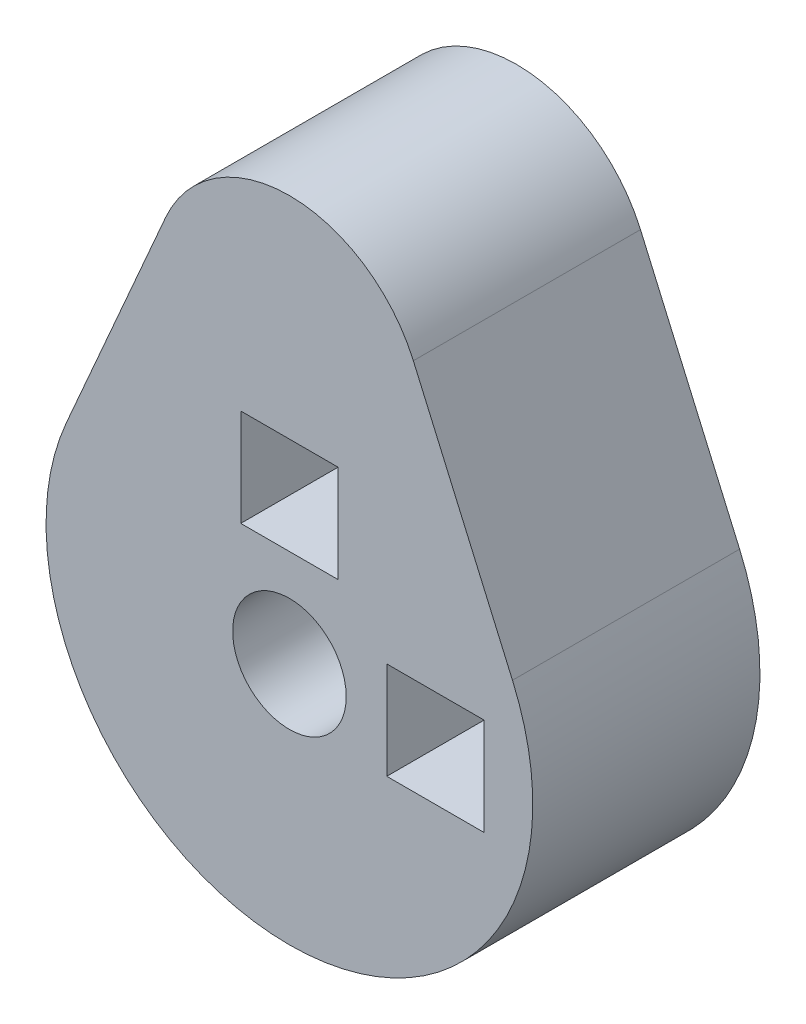
from build123d import *

# Parameters (mm, degrees)
SKETCH1_R           = 1.75
BOSS_EXTRUDE1_DEPTH = 7
SKETCH2_W           = 3
SKETCH2_H           = 3
CUT_EXTRUDE1_DEPTH  = 17.170961629


with BuildPart() as part:
    # Sketch1 → Boss-Extrude1 (new body)
    with BuildSketch(Plane.XY):
        with BuildLine():
            Line((-6.873863542, 3), (-3.818813079, 10))
            ThreePointArc((-3.818813079, 10), (0, 12.5), (3.818813079, 10))
            Line((3.818813079, 10), (6.873863542, 3))
            ThreePointArc((6.873863542, 3), (0, -7.5), (-6.873863542, 3))
        make_face()
        Circle(SKETCH1_R, mode=Mode.SUBTRACT)
    extrude(amount=BOSS_EXTRUDE1_DEPTH)

    # Sketch2 → Cut-Extrude1 (cut, through all)
    with BuildSketch(Plane.XY.offset(7)):
        with Locations((0, 4.5)):
            Rectangle(SKETCH2_W, SKETCH2_H)
        with Locations((4.5, 0)):
            Rectangle(SKETCH2_W, SKETCH2_H)
    extrude(amount=-CUT_EXTRUDE1_DEPTH, mode=Mode.SUBTRACT)


solid = part.part
